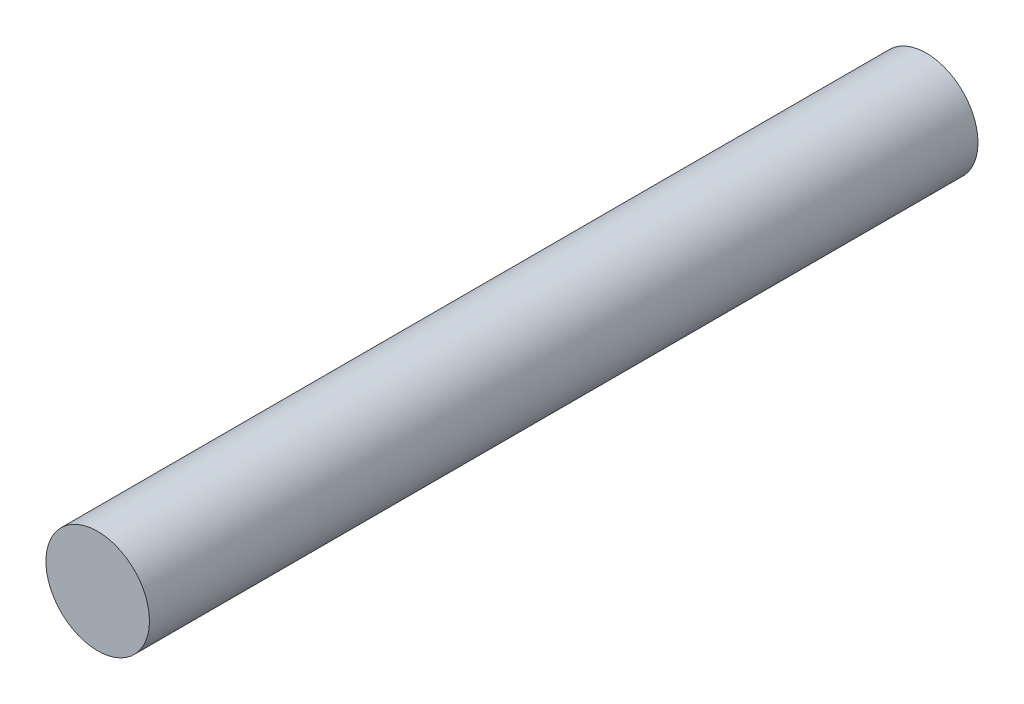
from build123d import *

# Parameters (mm, degrees)
SKETCH_2_R      = 0.25
EXTRUDE_1_DEPTH = 4


with BuildPart() as part:
    # 草图2 → 凸台-拉伸1 (new body)
    with BuildSketch(Plane.XY):
        Circle(SKETCH_2_R)
    extrude(amount=EXTRUDE_1_DEPTH)


solid = part.part
